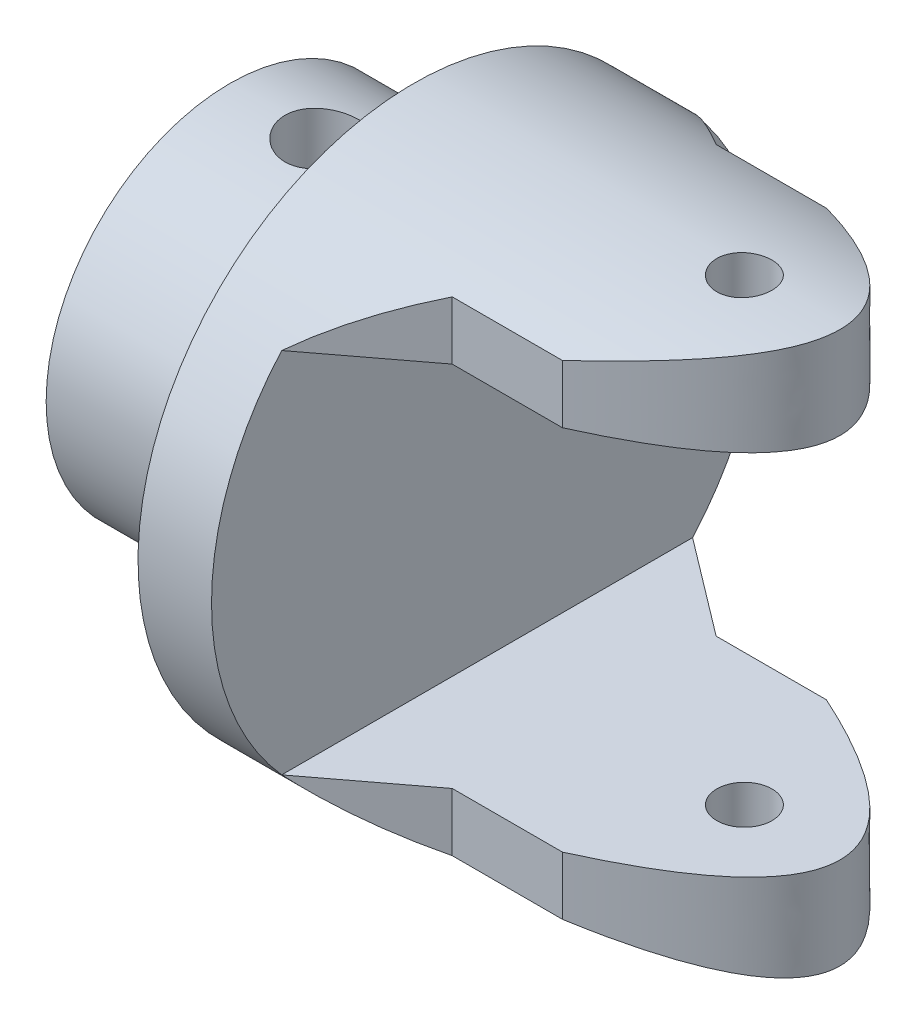
from build123d import *

# Parameters (mm, degrees)
SKETCH1_R               = 5
BOSS_EXTRUDE1_DEPTH     = 5
SKETCH2_R               = 7.5
BOSS_EXTRUDE2_DEPTH     = 2
BOSS_EXTRUDE3_DEPTH     = 10
CUT_EXTRUDE1_DEPTH      = 23.394195677
CUT_EXTRUDE1_DEPTH_BACK = 23.394195677
CUT_EXTRUDE2_DEPTH      = 23.092080194
CUT_EXTRUDE2_DEPTH_BACK = 23.092080194
SKETCH5_R               = 0.75
SKETCH6_R               = 2.5
CUT_EXTRUDE3_DEPTH      = 5
SKETCH7_R               = 1
CUT_EXTRUDE4_DEPTH      = 10


with BuildPart() as part:
    # Sketch1 → Boss-Extrude1 (new body)
    with BuildSketch(Plane(origin=(0, 0, 0), x_dir=(0, 0, -1), z_dir=(1, 0, 0))):
        Circle(SKETCH1_R)
    extrude(amount=BOSS_EXTRUDE1_DEPTH)

    # Sketch2 → Boss-Extrude2 (add)
    with BuildSketch(Plane(origin=(5, 0, 0), x_dir=(0, 0, -1), z_dir=(1, 0, 0))):
        Circle(SKETCH2_R)
    extrude(amount=BOSS_EXTRUDE2_DEPTH)

    # Sketch3 → Boss-Extrude3 (add)
    with BuildSketch(Plane(origin=(7, 0, 0), x_dir=(0, 0, -1), z_dir=(1, 0, 0))):
        with BuildLine():
            ThreePointArc((5.590169944, 5), (0, 7.5), (-5.590169944, 5))
            Line((-5.590169944, 5), (-4.898979486, 5))
            Line((-4.898979486, 5), (4.898979486, 5))
            Line((4.898979486, 5), (5.590169944, 5))
        make_face()
        with BuildLine():
            Line((-4.898979486, -5), (-5.590169944, -5))
            ThreePointArc((-5.590169944, -5), (0, -7.5), (5.590169944, -5))
            Line((5.590169944, -5), (4.898979486, -5))
            Line((4.898979486, -5), (-4.898979486, -5))
        make_face()
    extrude(amount=BOSS_EXTRUDE3_DEPTH)

    # Sketch4 → Cut-Extrude1 (cut, two sides: drawn at the far end of the back side and taken through both)
    with BuildSketch(Plane.XZ.offset(-5).offset(-CUT_EXTRUDE1_DEPTH_BACK)):
        with BuildLine():
            Line((7, 5.590169944), (17, 5.590169944))
            Line((17, 5.590169944), (17, -5.590169944))
            Line((17, -5.590169944), (7, -5.590169944))
            Line((7, -5.590169944), (9.640400827, -3.590169944))
            Line((9.640400827, -3.590169944), (12.640400827, -3.590169944))
            add(Edge.make_bspline(
                [(12.640400827, -3.590169944), (15.280133609, -2.393446629), (17.919866391, 0), (15.280133609, 2.393446629), (12.640400827, 3.590169944)],
                knots=[0.178885438, 0.178885438, 0.178885438, 0.178885438, 0.5, 0.821114562, 0.821114562, 0.821114562, 0.821114562], degree=3))
            Line((12.640400827, 3.590169944), (9.640400827, 3.590169944))
            Line((9.640400827, 3.590169944), (7, 5.590169944))
        make_face()
    extrude(amount=CUT_EXTRUDE1_DEPTH + CUT_EXTRUDE1_DEPTH_BACK, mode=Mode.SUBTRACT)

    # Sketch5 → Cut-Extrude2 (cut, two sides: drawn at the far end of the back side and taken through both)
    with BuildSketch(Plane.XZ.offset(-5).offset(-CUT_EXTRUDE2_DEPTH_BACK)):
        with Locations(Location((14, 0, 0), (0, 0, 270))):
            Circle(SKETCH5_R)
    extrude(amount=CUT_EXTRUDE2_DEPTH + CUT_EXTRUDE2_DEPTH_BACK, mode=Mode.SUBTRACT)

    # Sketch6 → Cut-Extrude3 (cut)
    with BuildSketch(Plane.ZY):
        Circle(SKETCH6_R)
    extrude(amount=-CUT_EXTRUDE3_DEPTH, mode=Mode.SUBTRACT)

    # Sketch7 → Cut-Extrude4 (cut, symmetric)
    with BuildSketch(Plane(origin=(0, 0, 0), x_dir=(1, 0, 0), z_dir=(0, 1, 0))):
        with Locations(Location((2.5, 0, 0), (0, 0, 270))):
            Circle(SKETCH7_R)
    extrude(amount=CUT_EXTRUDE4_DEPTH, both=True, mode=Mode.SUBTRACT)


solid = part.part
